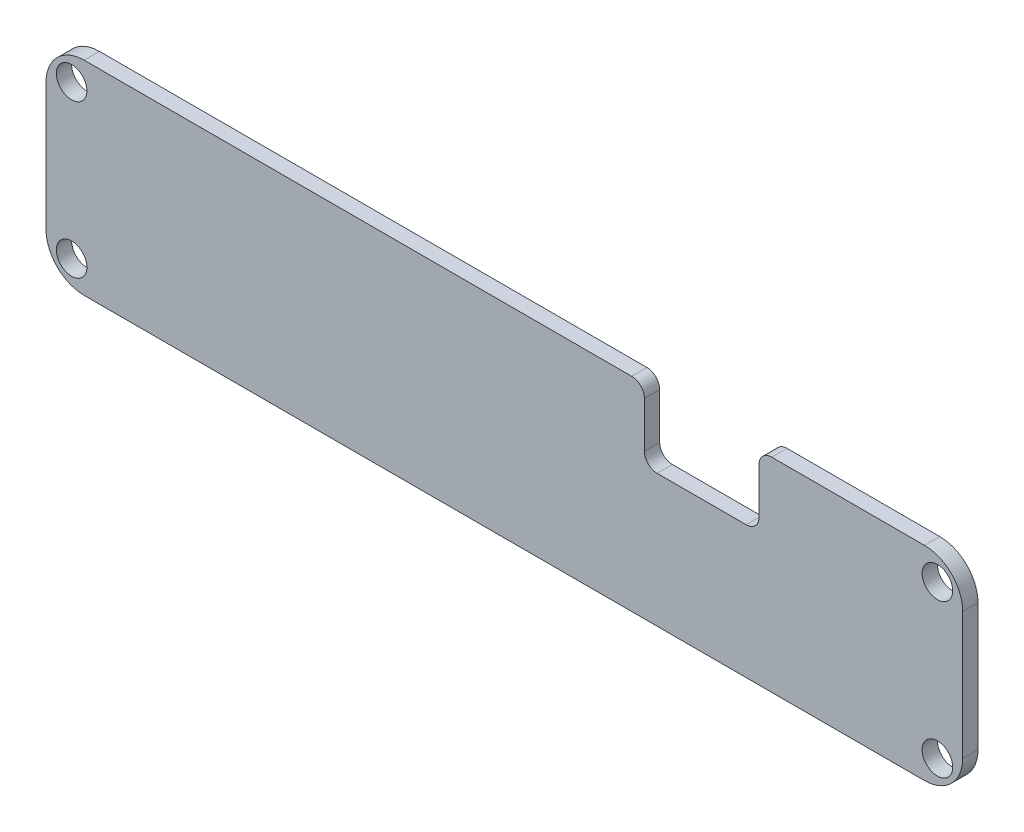
from build123d import *

# Parameters (mm, degrees)
SKETCH_1_W          = 72
SKETCH_1_H          = 16
EXTRUDE_1_DEPTH     = 1.2
FILLET_1_R          = 3
CUT_EXTRUDE_1_REACH = 75.766
SKETCH_3_R          = 1.2
CUT_EXTRUDE_2_REACH = 75.766
SKETCH_4_W          = 9
SKETCH_4_H          = 6
FILLET_2_R          = 1


with BuildPart() as part:
    # 草图1 → 凸台-拉伸1 (new body)
    with BuildSketch(Plane.XY):
        with Locations((36, 8)):
            Rectangle(SKETCH_1_W, SKETCH_1_H)
    extrude(amount=EXTRUDE_1_DEPTH)

    # 圆角1
    fillet_1_edges = [part.edges().sort_by_distance(p)[0] for p in [
        (0, 16, 0.6),
        (72, 16, 0.6),
        (72, 0, 0.6),
        (0, 0, 0.6),
    ]]
    fillet(fillet_1_edges, radius=FILLET_1_R)

    # 草图3 → 切除-拉伸1 (cut, up to next)
    with BuildSketch(Plane(origin=(0, 0, 0), x_dir=(-1, 0, 0), z_dir=(0, 0, -1)), mode=Mode.PRIVATE) as cut_extrude_1_sk1:
        with Locations((-70.012877826, 14.013032766)):
            Circle(SKETCH_3_R)
    cut_extrude_1_tool1 = extrude(cut_extrude_1_sk1.sketch, amount=-CUT_EXTRUDE_1_REACH, mode=Mode.PRIVATE) & part.part
    # 草图3 → 切除-拉伸1 (cut, up to next)
    with BuildSketch(Plane(origin=(0, 0, 0), x_dir=(-1, 0, 0), z_dir=(0, 0, -1)), mode=Mode.PRIVATE) as cut_extrude_1_sk2:
        with Locations((-70.012694945, 2.012672085)):
            Circle(SKETCH_3_R)
    cut_extrude_1_tool2 = extrude(cut_extrude_1_sk2.sketch, amount=-CUT_EXTRUDE_1_REACH, mode=Mode.PRIVATE) & part.part
    # 草图3 → 切除-拉伸1 (cut, up to next)
    with BuildSketch(Plane(origin=(0, 0, 0), x_dir=(-1, 0, 0), z_dir=(0, 0, -1)), mode=Mode.PRIVATE) as cut_extrude_1_sk3:
        with Locations((-2.011949988, 14.012003328)):
            Circle(SKETCH_3_R)
    cut_extrude_1_tool3 = extrude(cut_extrude_1_sk3.sketch, amount=-CUT_EXTRUDE_1_REACH, mode=Mode.PRIVATE) & part.part
    # 草图3 → 切除-拉伸1 (cut, up to next)
    with BuildSketch(Plane(origin=(0, 0, 0), x_dir=(-1, 0, 0), z_dir=(0, 0, -1)), mode=Mode.PRIVATE) as cut_extrude_1_sk4:
        with Locations((-2.012501905, 2.013009906)):
            Circle(SKETCH_3_R)
    cut_extrude_1_tool4 = extrude(cut_extrude_1_sk4.sketch, amount=-CUT_EXTRUDE_1_REACH, mode=Mode.PRIVATE) & part.part
    add(cut_extrude_1_tool1.solids().sort_by_distance((70.012878, 14.013033, 0))[0], mode=Mode.SUBTRACT)
    add(cut_extrude_1_tool2.solids().sort_by_distance((70.012695, 2.012672, 0))[0], mode=Mode.SUBTRACT)
    add(cut_extrude_1_tool3.solids().sort_by_distance((2.01195, 14.012003, 0))[0], mode=Mode.SUBTRACT)
    add(cut_extrude_1_tool4.solids().sort_by_distance((2.012502, 2.01301, 0))[0], mode=Mode.SUBTRACT)

    # 草图4 → 切除-拉伸2 (cut, up to next)
    with BuildSketch(Plane(origin=(0, 0, 0), x_dir=(-1, 0, 0), z_dir=(0, 0, -1)), mode=Mode.PRIVATE) as cut_extrude_2_sk1:
        with Locations((-51.5, 13.4)):
            Rectangle(SKETCH_4_W, SKETCH_4_H)
    cut_extrude_2_tool1 = extrude(cut_extrude_2_sk1.sketch, amount=-CUT_EXTRUDE_2_REACH, mode=Mode.PRIVATE) & part.part
    add(cut_extrude_2_tool1.solids().sort_by_distance((51.5, 13.4, 0))[0], mode=Mode.SUBTRACT)

    # 圆角2
    fillet_2_edges = [part.edges().sort_by_distance(p)[0] for p in [
        (56, 16, 0.6),
        (47, 16, 0.6),
        (56, 10.4, 0.6),
        (47, 10.4, 0.6),
    ]]
    fillet(fillet_2_edges, radius=FILLET_2_R)


solid = part.part
